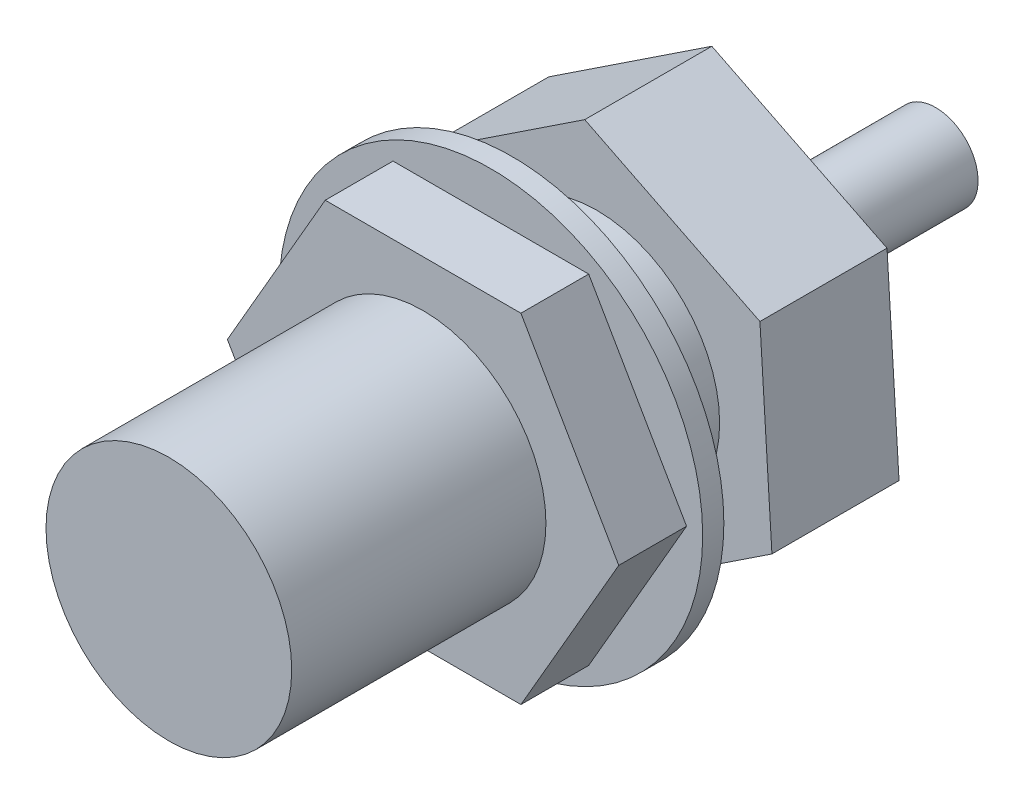
from build123d import *

# Parameters (mm, degrees)
SKETCH1_R           = 2.9
BOSS_EXTRUDE1_DEPTH = 3
BOSS_EXTRUDE2_DEPTH = 1.6
SKETCH3_R           = 5
BOSS_EXTRUDE3_DEPTH = 0.5
SKETCH4_R           = 2.9
BOSS_EXTRUDE4_DEPTH = 2
BOSS_EXTRUDE5_DEPTH = 3
SKETCH6_R           = 1
BOSS_EXTRUDE6_DEPTH = 5


with BuildPart() as part:
    # Sketch1 → Boss-Extrude1 (new, symmetric)
    with BuildSketch(Plane.XY):
        Circle(SKETCH1_R)
    extrude(amount=BOSS_EXTRUDE1_DEPTH, both=True)

    # Sketch2 → Boss-Extrude2 (add)
    with BuildSketch(Plane(origin=(0, 0, -3), x_dir=(-1, 0, 0), z_dir=(0, 0, -1))):
        Polygon((4.618802154, 0), (2.309401077, 4), (-2.309401077, 4), (-4.618802154, 0), (-2.309401077, -4), (2.309401077, -4), align=None)
    extrude(amount=BOSS_EXTRUDE2_DEPTH)

    # Sketch3 → Boss-Extrude3 (add)
    with BuildSketch(Plane(origin=(0, 0, -4.6), x_dir=(-1, 0, 0), z_dir=(0, 0, -1))):
        Circle(SKETCH3_R)
    extrude(amount=BOSS_EXTRUDE3_DEPTH)

    # Sketch4 → Boss-Extrude4 (add)
    with BuildSketch(Plane(origin=(0, 0, -5.1), x_dir=(-1, 0, 0), z_dir=(0, 0, -1))):
        with Locations(Location((0, 0, 0), (0, 0, 180))):
            Circle(SKETCH4_R)
    extrude(amount=BOSS_EXTRUDE4_DEPTH)

    # Sketch5 → Boss-Extrude5 (add)
    with BuildSketch(Plane(origin=(0, 0, -7.1), x_dir=(-1, 0, 0), z_dir=(0, 0, -1))):
        Polygon((4.134382211, 2.059178737), (0.283890008, 4.610069392), (-3.850492202, 2.550890655), (-4.134382211, -2.059178737), (-0.283890008, -4.610069392), (3.850492202, -2.550890655), align=None)
    extrude(amount=BOSS_EXTRUDE5_DEPTH)

    # Sketch6 → Boss-Extrude6 (add)
    with BuildSketch(Plane(origin=(0, 0, -10.1), x_dir=(-1, 0, 0), z_dir=(0, 0, -1))):
        Circle(SKETCH6_R)
    extrude(amount=BOSS_EXTRUDE6_DEPTH)


solid = part.part
